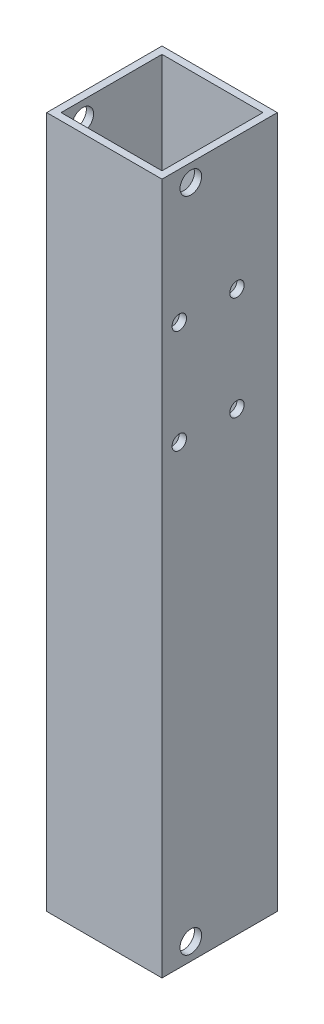
from build123d import *

# Parameters (mm, degrees)
SKETCH1_W                      = 25.4
SKETCH1_H                      = 152.4
BOSS_EXTRUDE1_DEPTH            = 25.4
SKETCH2_W                      = 22.225
SKETCH2_H                      = 22.225
CUT_EXTRUDE1_DEPTH             = 279.4
F_3_16_0_1875_DIAMETER_HOLE2_D = 4.7625
F_1_8_0_125_DIAMETER_HOLE1_D   = 3.175


with BuildPart() as part:
    # Sketch1 → Boss-Extrude1 (new body)
    with BuildSketch(Plane.XY):
        with Locations((76.086049872, -101.14964539)):
            Rectangle(SKETCH1_W, SKETCH1_H)
    extrude(amount=BOSS_EXTRUDE1_DEPTH)

    # Sketch2 → Cut-Extrude1 (cut)
    with BuildSketch(Plane(origin=(0, -24.94964539, 0), x_dir=(1, 0, 0), z_dir=(0, 1, 0))):
        with Locations((76.086049872, -12.7)):
            Rectangle(SKETCH2_W, SKETCH2_H)
    extrude(amount=-CUT_EXTRUDE1_DEPTH, mode=Mode.SUBTRACT)

    # 3/16 (0.1875) Diameter Hole2 (through all)
    with Locations(Plane(origin=(88.786049872, 0, 0), x_dir=(0, 0, -1), z_dir=(1, 0, 0))):
        with Locations((-19.05, -173.53964539), (-19.05, -28.75964539)):
            Hole(F_3_16_0_1875_DIAMETER_HOLE2_D / 2)

    # 1/8 (0.125) Diameter Hole1 (through all)
    with Locations(Plane(origin=(88.786049872, 0, 0), x_dir=(0, 0, -1), z_dir=(1, 0, 0))):
        with Locations((-21.59, -77.01964539), (-8.89, -77.01964539), (-21.59, -54.15964539), (-8.89, -54.15964539)):
            Hole(F_1_8_0_125_DIAMETER_HOLE1_D / 2)


solid = part.part
